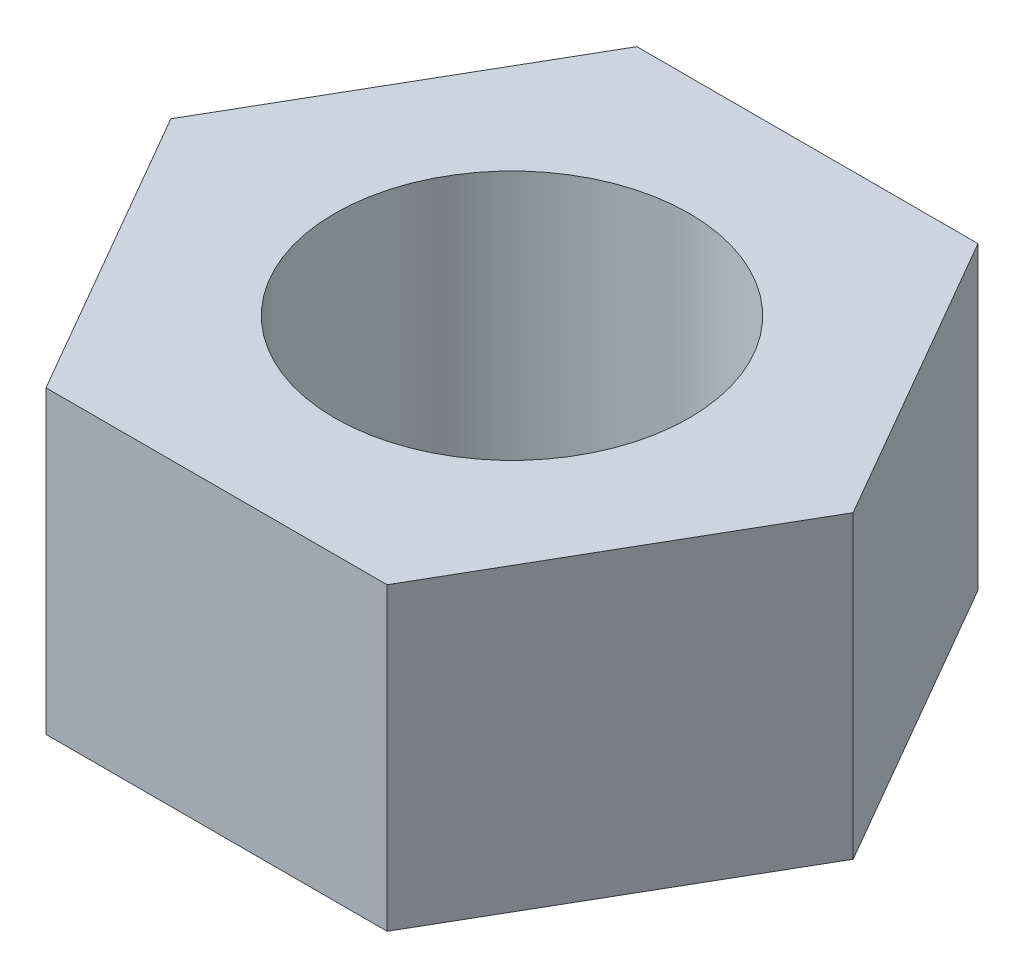
from build123d import *

# Parameters (mm, degrees)
BOSS_EXTRUDE1_DEPTH = 5.08
SKETCH2_R           = 3
CUT_EXTRUDE1_DEPTH  = 10.172758582


with BuildPart() as part:
    # Sketch1 → Boss-Extrude1 (new body)
    with BuildSketch(Plane(origin=(0, 0, 0), x_dir=(1, 0, 0), z_dir=(0, 1, 0))):
        Polygon((2.886745572, 4.99999), (-2.886745572, 4.99999), (-5.773491145, 0), (-2.886745572, -4.99999), (2.886745572, -4.99999), (5.773491145, 0), align=None)
    extrude(amount=BOSS_EXTRUDE1_DEPTH)

    # Sketch2 → Cut-Extrude1 (cut, through all)
    with BuildSketch(Plane(origin=(0, 5.08, 0), x_dir=(1, 0, 0), z_dir=(0, 1, 0))):
        with Locations(Location((0, 0, 0), (0, 0, 270))):
            Circle(SKETCH2_R)
    extrude(amount=-CUT_EXTRUDE1_DEPTH, mode=Mode.SUBTRACT)


solid = part.part
